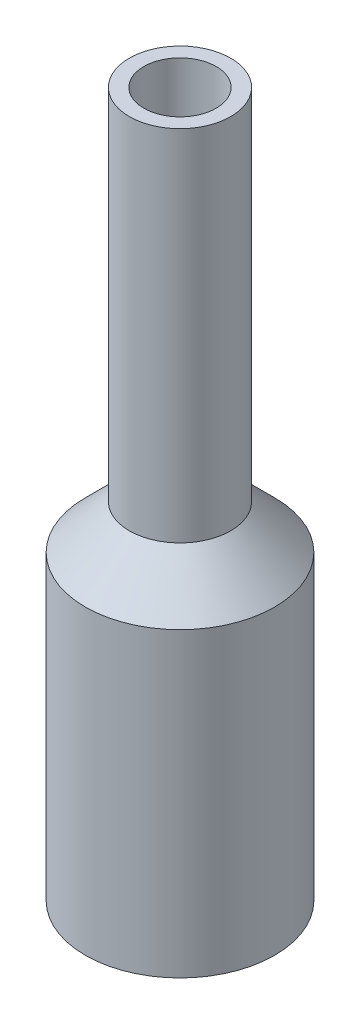
from build123d import *

# Parameters (mm, degrees)
SKETCH2_W = 0.3
SKETCH2_H = 8


with BuildPart() as part:
    # Sketch3 → Revolve1 (revolve)
    with BuildSketch(Plane.XY):
        Polygon((0.9, 2.676607812), (1.05, 2.676607812), (1.05, 3.240637489), (1.96196636, 2.328671129), (1.96196636, -3.923392188), (1.838146931, -3.923392188), (1.838146931, 2.328671129), align=None)
    revolve(axis=Axis((0, 19.759006236, 0), (0, -1, 0)))

    # Sketch2 → Revolve2 (revolve)
    with BuildSketch(Plane.XY):
        with Locations((0.9, 6.676607812)):
            Rectangle(SKETCH2_W, SKETCH2_H)
    revolve(axis=Axis((0, 19.759006236, 0), (0, -1, 0)))


solid = part.part
